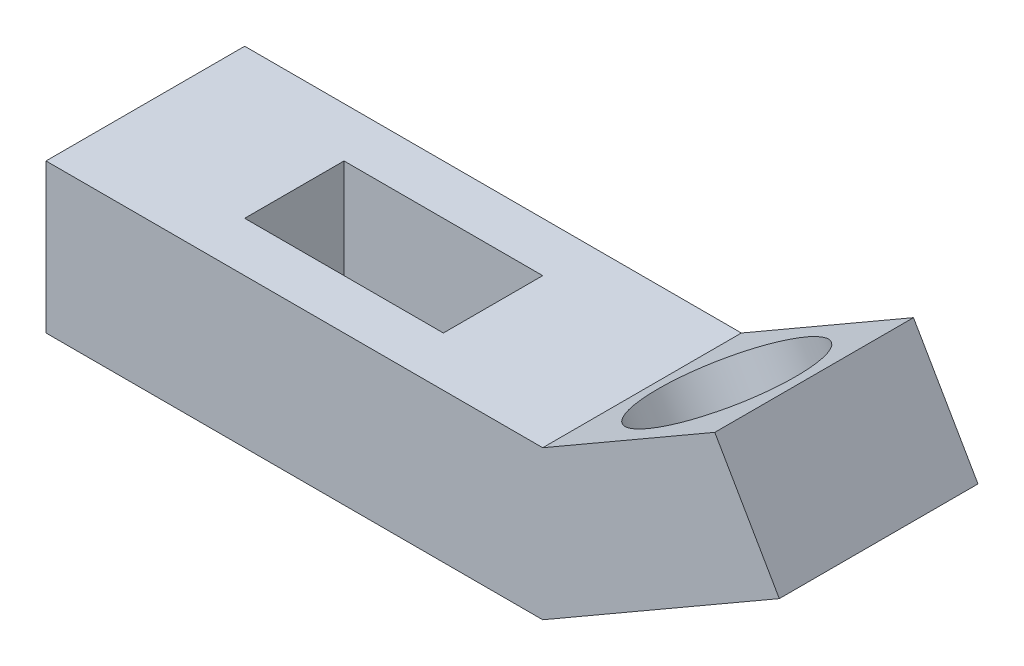
from build123d import *

# Parameters (mm, degrees)
SKETCH_1_W          = 50
SKETCH_1_H          = 20
SKETCH_1_W_2        = 20
SKETCH_1_H_2        = 10
EXTRUDE_1_DEPTH     = 15
EXTRUDE_2_DEPTH     = 20
SKETCH_3_R          = 8
CUT_EXTRUDE_1_DEPTH = 56.775595694


with BuildPart() as part:
    # 草图1 → 凸台-拉伸1 (new body)
    with BuildSketch(Plane(origin=(0, 0, 0), x_dir=(1, 0, 0), z_dir=(0, 1, 0))):
        Rectangle(SKETCH_1_W, SKETCH_1_H)
        Rectangle(SKETCH_1_W_2, SKETCH_1_H_2, mode=Mode.SUBTRACT)
    extrude(amount=EXTRUDE_1_DEPTH)

    # 草图2 → 凸台-拉伸2 (add)
    with BuildSketch(Plane.XY.offset(10)):
        Polygon((25, 15), (42.320508076, 25), (48.815698604, 13.75), (25, 0), align=None)
    extrude(amount=-EXTRUDE_2_DEPTH)

    # 草图3 → 切除-拉伸1 (cut, through all)
    with BuildSketch(Plane(origin=(-0.245190528, 0.424682453, 0), x_dir=(0.8660254037844378, 0.5000000000000017, 0), z_dir=(-0.5000000000000016, 0.8660254037844377, 0))):
        with Locations(Location((39, 0, 0), (0, 0, 180))):
            Circle(SKETCH_3_R)
    extrude(amount=-CUT_EXTRUDE_1_DEPTH, mode=Mode.SUBTRACT)


solid = part.part
